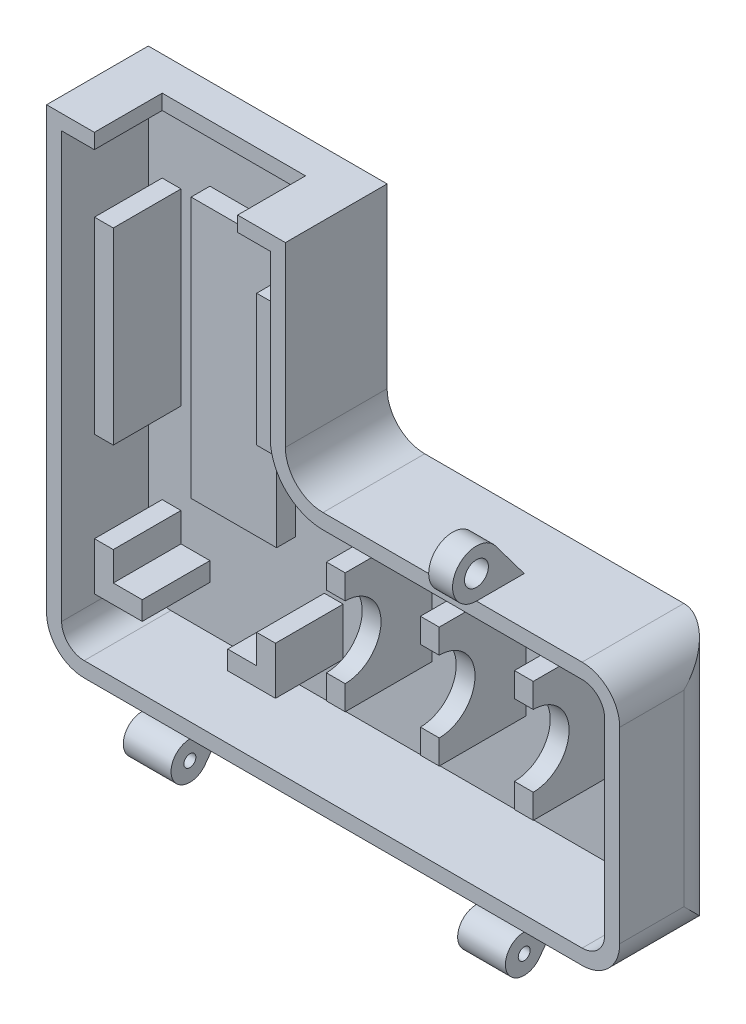
from build123d import *

# Parameters (mm, degrees)
SALIENTE_EXTRUIR1_DEPTH = 54.1
REDONDEO1_R             = 10
CROQUIS2_W              = 27.05
CROQUIS2_H              = 127
CORTAR_EXTRUIR1_DEPTH   = 206.624828267
VACIADO1_T              = -4
CROQUIS3_W              = 22.730580246
CROQUIS3_H              = 69.392963169
SALIENTE_EXTRUIR2_DEPTH = 5
CROQUIS3_3_W            = 5
CROQUIS3_3_H            = 50
CROQUIS3_3_H_2          = 35
SALIENTE_EXTRUIR3_DEPTH = 18
CROQUIS4_W              = 5
CROQUIS4_H              = 32.000123075
SALIENTE_EXTRUIR4_DEPTH = 23.05
CORTAR_EXTRUIR2_REACH   = 185.317
CROQUIS5_R              = 9.525
CROQUIS6_W              = 38.1
CROQUIS6_H              = 42.277753805
CORTAR_EXTRUIR3_DEPTH   = 18
SALIENTE_EXTRUIR5_DEPTH = 12.7
SALIENTE_EXTRUIR6_START = -12.7
SALIENTE_EXTRUIR6_DEPTH = 12.7
CROQUIS9_R              = 1.5875
CORTAR_EXTRUIR4_DEPTH   = 183.442326503
CROQUIS10_R             = 3.175
SALIENTE_EXTRUIR7_DEPTH = 6.35


with BuildPart() as part:
    # Croquis1 → Saliente-Extruir1 (new body)
    with BuildSketch(Plane.XY):
        Polygon((0, 0), (0, 127), (63.5, 127), (63.5, 69.85), (152.4, 69.85), (152.4, 0), align=None)
    extrude(amount=SALIENTE_EXTRUIR1_DEPTH)

    # Redondeo1
    redondeo1_edges = [part.edges().sort_by_distance(p)[0] for p in [
        (63.5, 69.85, 27.05),
        (152.4, 69.85, 27.05),
        (152.4, 0, 27.05),
        (0, 0, 27.05),
        (152.4, 34.925, 0),
    ]]
    fillet(redondeo1_edges, radius=REDONDEO1_R)

    # Croquis2 → Cortar-Extruir1 (cut, through all)
    with BuildSketch(Plane(origin=(152.4, 0, 0), x_dir=(0, 0, -1), z_dir=(1, 0, 0))):
        with Locations((-40.575, 63.5)):
            Rectangle(CROQUIS2_W, CROQUIS2_H)
    extrude(amount=-CORTAR_EXTRUIR1_DEPTH, mode=Mode.SUBTRACT)

    # Vaciado1
    vaciado1_openings = [part.faces().sort_by_distance(p)[0] for p in [
        (64.737748774, 51.223088278, 27.05),
    ]]
    offset(amount=VACIADO1_T, openings=vaciado1_openings)

    # Croquis3 → Saliente-Extruir2 (add)
    with BuildSketch(Plane.XY.offset(4)):
        with Locations((31.75, 72.216754897)):
            Rectangle(CROQUIS3_W, CROQUIS3_H)
    extrude(amount=SALIENTE_EXTRUIR2_DEPTH)

    # Croquis3<3> → Saliente-Extruir3 (add)
    with BuildSketch(Plane.XY.offset(4)):
        with Locations((10.184709877, 77.438130808)):
            Rectangle(CROQUIS3_3_W, CROQUIS3_3_H)
        with Locations((53.315290123, 88.988130808)):
            Rectangle(CROQUIS3_3_W, CROQUIS3_3_H_2)
        Polygon((50.815290123, 20.688130808), (43.115290123, 20.688130808), (43.115290123, 15.688130808), (55.815290123, 15.688130808), (55.815290123, 28.388130808), (50.815290123, 28.388130808), align=None)
        Polygon((20.384709877, 20.688130808), (12.684709877, 20.688130808), (12.684709877, 28.388130808), (7.684709877, 28.388130808), (7.684709877, 15.688130808), (20.384709877, 15.688130808), align=None)
    extrude(amount=SALIENTE_EXTRUIR3_DEPTH)

    # Croquis4 → Saliente-Extruir4 (add)
    with BuildSketch(Plane.XY.offset(4)):
        with Locations((76.9, 42.913130808)):
            Rectangle(CROQUIS4_W, CROQUIS4_H)
        with Locations((101.9, 42.913130808)):
            Rectangle(CROQUIS4_W, CROQUIS4_H)
        with Locations((126.9, 42.913130808)):
            Rectangle(CROQUIS4_W, CROQUIS4_H)
    extrude(amount=SALIENTE_EXTRUIR4_DEPTH)

    # Cortar-Extruir2: up to this face of the body (flat: up to its plane)
    cortar_extruir2_end = Plane(part.part.faces().sort_by_distance((55.815290123, 22.038130808, 13))[0])
    # Croquis5 → Cortar-Extruir2 (cut, up to the picked face)
    with BuildSketch(Plane(origin=(129.4, 0, 0), x_dir=(0, 0, -1), z_dir=(1, 0, 0)), mode=Mode.PRIVATE) as cortar_extruir2_sk1:
        with Locations((-27.05, 42.913130808)):
            Circle(CROQUIS5_R)
    cortar_extruir2_tool1 = split(extrude(cortar_extruir2_sk1.sketch, amount=-CORTAR_EXTRUIR2_REACH, mode=Mode.PRIVATE), bisect_by=cortar_extruir2_end, keep=Keep.BOTH, mode=Mode.PRIVATE)
    add(cortar_extruir2_tool1.solids().sort_by(Axis((129.4, 42.913131, 27.05), (-1, 0, 0)))[0], mode=Mode.SUBTRACT)

    # Croquis6 → Cortar-Extruir3 (cut)
    with BuildSketch(Plane.XZ.offset(-123)):
        with Locations((31.75, 30.138876903)):
            Rectangle(CROQUIS6_W, CROQUIS6_H)
    extrude(amount=-CORTAR_EXTRUIR3_DEPTH, mode=Mode.SUBTRACT)

    # Croquis7 → Saliente-Extruir5 (add)
    with BuildSketch(Plane(origin=(127, 0, 0), x_dir=(0, 0, -1), z_dir=(1, 0, 0))):
        with BuildLine():
            Line((-27.05, 0), (-17.144, 0))
            Line((-17.144, 0), (-23.027384209, -7.969606405))
            ThreePointArc((-23.027384209, -7.969606405), (-31.513632603, -7.252994449), (-27.05, 0))
        make_face()
    extrude(amount=-SALIENTE_EXTRUIR5_DEPTH)

    # Croquis8 → Saliente-Extruir6 (add)
    with BuildSketch(Plane.ZY.offset(-25.4).offset(SALIENTE_EXTRUIR6_START)):
        with BuildLine():
            Line((23.027384209, -7.969606405), (17.144, 0))
            Line((17.144, 0), (27.05, 0))
            ThreePointArc((27.05, 0), (31.513632603, -7.252994449), (23.027384209, -7.969606405))
        make_face()
    extrude(amount=SALIENTE_EXTRUIR6_DEPTH)

    # Croquis9 → Cortar-Extruir4 (cut, through all)
    with BuildSketch(Plane(origin=(127, 0, 0), x_dir=(0, 0, -1), z_dir=(1, 0, 0))):
        with Locations(Location((-27.05, -5, 0), (0, 0, 180))):
            Circle(CROQUIS9_R)
    extrude(amount=-CORTAR_EXTRUIR4_DEPTH, mode=Mode.SUBTRACT)

    # Croquis10 → Saliente-Extruir7 (add)
    with BuildSketch(Plane(origin=(107.95, 0, 0), x_dir=(0, 0, -1), z_dir=(1, 0, 0))):
        with BuildLine():
            Line((-21.97, 80.01), (-14.35, 69.85))
            Line((-14.35, 69.85), (-27.05, 69.85))
            ThreePointArc((-27.05, 69.85), (-32.729612663, 79.039806331), (-21.97, 80.01))
        make_face()
        with Locations((-27.05, 76.2)):
            Circle(CROQUIS10_R, mode=Mode.SUBTRACT)
    extrude(amount=SALIENTE_EXTRUIR7_DEPTH)


solid = part.part
